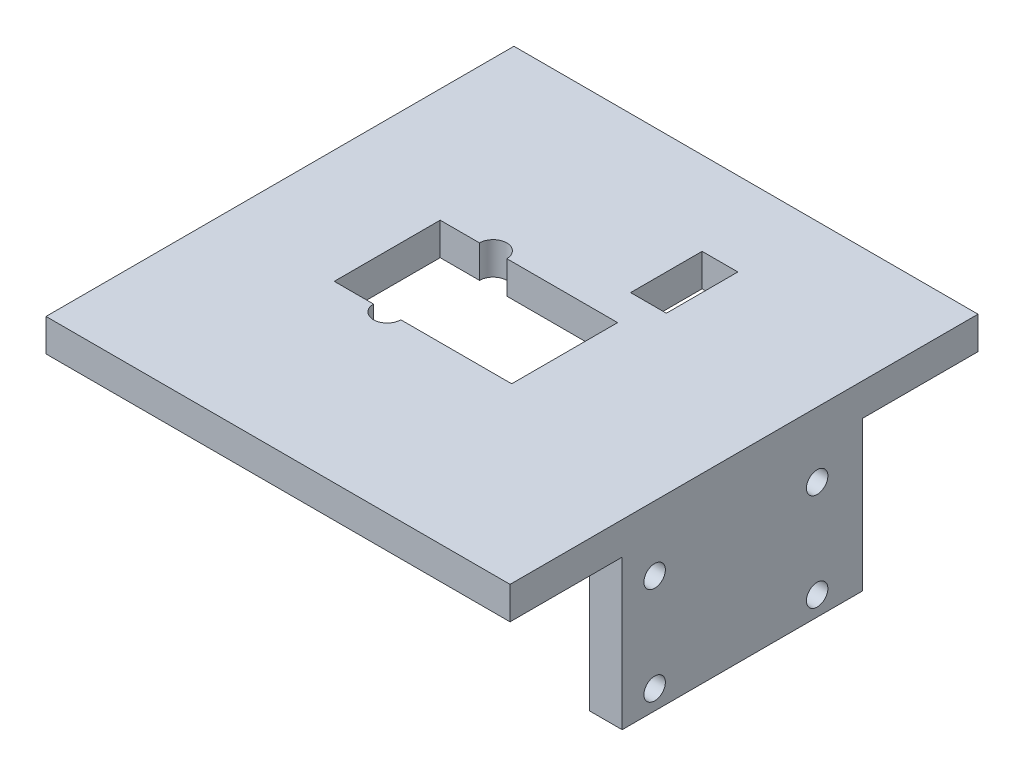
from build123d import *

# Parameters (mm, degrees)
SKETCH_1_W          = 55
SKETCH_1_H          = 70
EXTRUDE_1_DEPTH     = 5
SKETCH_2_W          = 37
SKETCH_2_H          = 28
EXTRUDE_2_DEPTH     = 5
SKETCH_3_R          = 1.65
CUT_EXTRUDE_1_DEPTH = 5
SKETCH_5_W          = 55
SKETCH_5_H          = 15.75
EXTRUDE_3_DEPTH     = 5
SKETCH_6_W          = 55
SKETCH_6_H          = 15.75
CUT_EXTRUDE_2_DEPTH = 5
CUT_EXTRUDE_3_DEPTH = 5
SKETCH_9_W          = 5.5
SKETCH_9_H          = 11
CUT_EXTRUDE_4_DEPTH = 8
SKETCH_11_W         = 16.4
SKETCH_11_H         = 70
EXTRUDE_4_DEPTH     = 5
SKETCH_12_W         = 71.4
SKETCH_12_H         = 2
EXTRUDE_5_DEPTH     = 5


with BuildPart() as part:
    # 草图1 → 凸台-拉伸1 (new body)
    with BuildSketch(Plane(origin=(0, 0, 0), x_dir=(1, 0, 0), z_dir=(0, 1, 0))):
        with Locations((27.5, -35)):
            Rectangle(SKETCH_1_W, SKETCH_1_H)
    extrude(amount=EXTRUDE_1_DEPTH)

    # 草图2 → 凸台-拉伸2 (add)
    with BuildSketch(Plane(origin=(55, 0, 0), x_dir=(0, 0, -1), z_dir=(1, 0, 0))):
        with Locations((-18.5, -9)):
            Rectangle(SKETCH_2_W, SKETCH_2_H)
    extrude(amount=-EXTRUDE_2_DEPTH)

    # 草图3 → 切除-拉伸1 (cut)
    with BuildSketch(Plane(origin=(55, 0, 0), x_dir=(0, 0, -1), z_dir=(1, 0, 0))):
        with Locations((-7, -5)):
            Circle(SKETCH_3_R)
        with Locations((-32, -5)):
            Circle(SKETCH_3_R)
        with Locations((-32, -20)):
            Circle(SKETCH_3_R)
        with Locations((-7, -20)):
            Circle(SKETCH_3_R)
    extrude(amount=-CUT_EXTRUDE_1_DEPTH, mode=Mode.SUBTRACT)

    # 草图5 → 凸台-拉伸3 (add)
    with BuildSketch(Plane(origin=(0, 5, 0), x_dir=(1, 0, 0), z_dir=(0, 1, 0))):
        with Locations((27.5, 7.875)):
            Rectangle(SKETCH_5_W, SKETCH_5_H)
    extrude(amount=-EXTRUDE_3_DEPTH)

    # 草图6 → 切除-拉伸2 (cut)
    with BuildSketch(Plane(origin=(0, 5, 0), x_dir=(1, 0, 0), z_dir=(0, 1, 0))):
        with Locations((27.5, -62.125)):
            Rectangle(SKETCH_6_W, SKETCH_6_H)
    extrude(amount=-CUT_EXTRUDE_2_DEPTH, mode=Mode.SUBTRACT)

    # 草图8 → 切除-拉伸3 (cut)
    with BuildSketch(Plane(origin=(0, 5, 0), x_dir=(1, 0, 0), z_dir=(0, 1, 0))):
        with BuildLine():
            Line((17.4, -11.1), (28.4, -11.1))
            Line((28.4, -11.1), (28.4, -27.4))
            Line((28.4, -27.4), (17.4, -27.4))
            Line((17.4, -27.4), (11.35, -27.4))
            ThreePointArc((11.35, -27.4), (9.25, -29.5), (7.15, -27.4))
            Line((7.15, -27.4), (1.1, -27.4))
            Line((1.1, -27.4), (1.1, -11.1))
            Line((1.1, -11.1), (7.15, -11.1))
            ThreePointArc((7.15, -11.1), (9.25, -9), (11.35, -11.1))
            Line((11.35, -11.1), (17.4, -11.1))
        make_face()
    extrude(amount=-CUT_EXTRUDE_3_DEPTH, mode=Mode.SUBTRACT)

    # 草图9 → 切除-拉伸4 (cut)
    with BuildSketch(Plane(origin=(0, 5, 0), x_dir=(1, 0, 0), z_dir=(0, 1, 0))):
        with Locations((28.15, -0.6)):
            Rectangle(SKETCH_9_W, SKETCH_9_H)
    extrude(amount=-CUT_EXTRUDE_4_DEPTH, mode=Mode.SUBTRACT)

    # 草图11 → 凸台-拉伸4 (add)
    with BuildSketch(Plane(origin=(0, 5, 0), x_dir=(1, 0, 0), z_dir=(0, 1, 0))):
        with Locations((-8.2, -19.25)):
            Rectangle(SKETCH_11_W, SKETCH_11_H)
    extrude(amount=-EXTRUDE_4_DEPTH)

    # 草图12 → 凸台-拉伸5 (add)
    with BuildSketch(Plane(origin=(0, 5, 0), x_dir=(1, 0, 0), z_dir=(0, 1, 0))):
        with Locations((19.3, 16.75)):
            Rectangle(SKETCH_12_W, SKETCH_12_H)
    extrude(amount=-EXTRUDE_5_DEPTH)


solid = part.part
